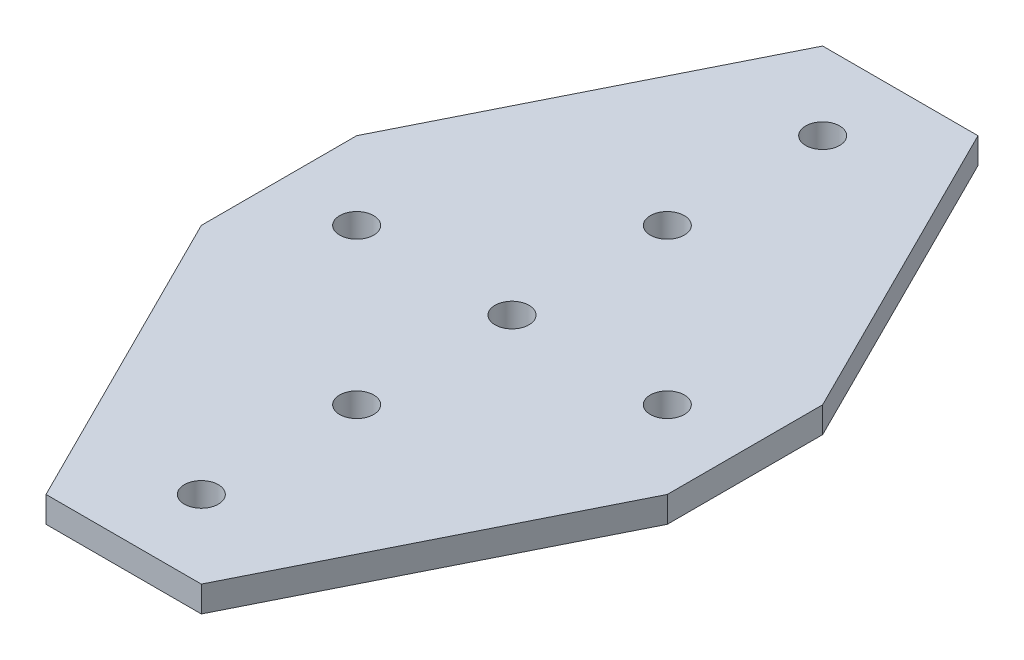
from build123d import *

# Parameters (mm, degrees)
SKETCH1_R           = 4.1656
BOSS_EXTRUDE1_DEPTH = 6.35


with BuildPart() as part:
    # Sketch1 → Boss-Extrude1 (new body)
    with BuildSketch(Plane(origin=(0, 0, 0), x_dir=(1, 0, 0), z_dir=(0, 1, 0))):
        Polygon((-73.100424588, 81.91031941), (-35.000424588, 81.91031941), (3.099575412, 5.71031941), (3.099575412, -32.38968059), (-35.000424588, -108.58968059), (-73.100424588, -108.58968059), (-111.200424588, -32.38968059), (-111.200424588, 5.71031941), align=None)
        with Locations(Location((-92.150424588, -13.33968059, 0), (0, 0, 270))):
            Circle(SKETCH1_R, mode=Mode.SUBTRACT)
        with Locations(Location((-54.050424588, -13.33968059, 0), (0, 0, 270))):
            Circle(SKETCH1_R, mode=Mode.SUBTRACT)
        with Locations(Location((-15.950424588, -13.33968059, 0), (0, 0, 270))):
            Circle(SKETCH1_R, mode=Mode.SUBTRACT)
        with Locations(Location((-54.050424588, 24.76031941, 0), (0, 0, 270))):
            Circle(SKETCH1_R, mode=Mode.SUBTRACT)
        with Locations(Location((-54.050424588, 62.86031941, 0), (0, 0, 270))):
            Circle(SKETCH1_R, mode=Mode.SUBTRACT)
        with Locations(Location((-54.050424588, -51.43968059, 0), (0, 0, 270))):
            Circle(SKETCH1_R, mode=Mode.SUBTRACT)
        with Locations(Location((-54.050424588, -89.53968059, 0), (0, 0, 270))):
            Circle(SKETCH1_R, mode=Mode.SUBTRACT)
    extrude(amount=BOSS_EXTRUDE1_DEPTH)


solid = part.part
